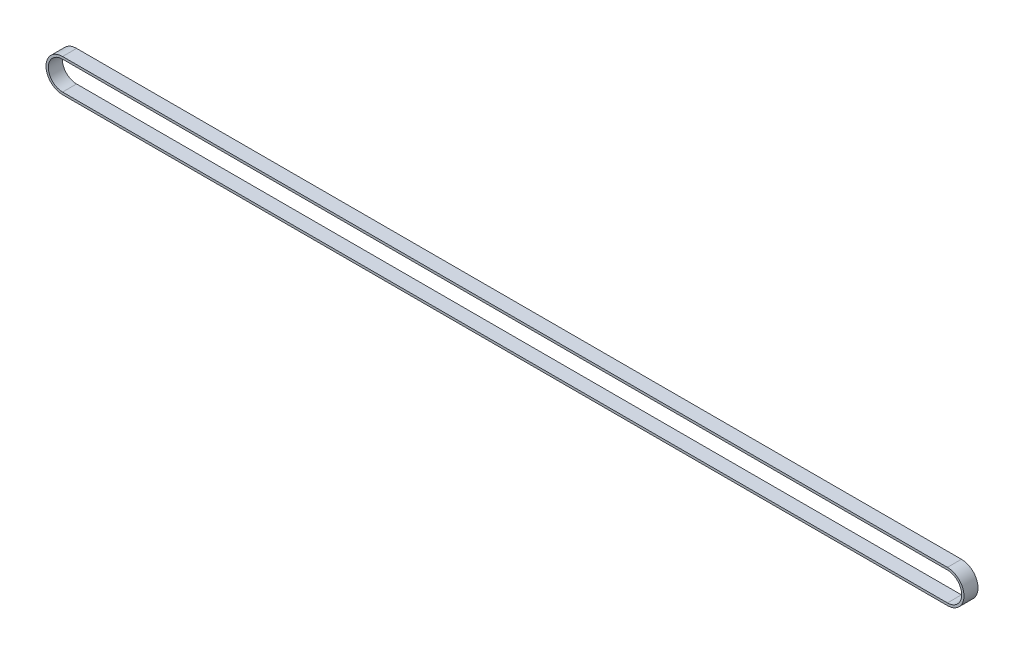
from build123d import *

# Parameters (mm, degrees)
EXTRUDE_THIN1_DEPTH = 6


with BuildPart() as part:
    # Sketch2 → Extrude-Thin1 (new body)
    with BuildSketch(Plane.XY):
        with BuildLine():
            Line((189.55, -6.1), (0, -6.1))
            ThreePointArc((0, -6.1), (-6.1, 0), (0, 6.1))
            Line((0, 6.1), (189.55, 6.1))
            Line((189.55, 6.1), (189.55, 7.1))
            Line((189.55, 7.1), (0, 7.1))
            ThreePointArc((0, 7.1), (-7.1, 0), (0, -7.1))
            Line((0, -7.1), (189.55, -7.1))
            Line((189.55, -7.1), (189.55, -6.1))
        make_face()
    extrude_thin1 = extrude(amount=EXTRUDE_THIN1_DEPTH)

    # Mirror1: Extrude-Thin1 across plane
    add(extrude_thin1.mirror(Plane(origin=(189.55, 7.1, 6), x_dir=(0, 0, 1), z_dir=(1, 0, 0))))


solid = part.part
